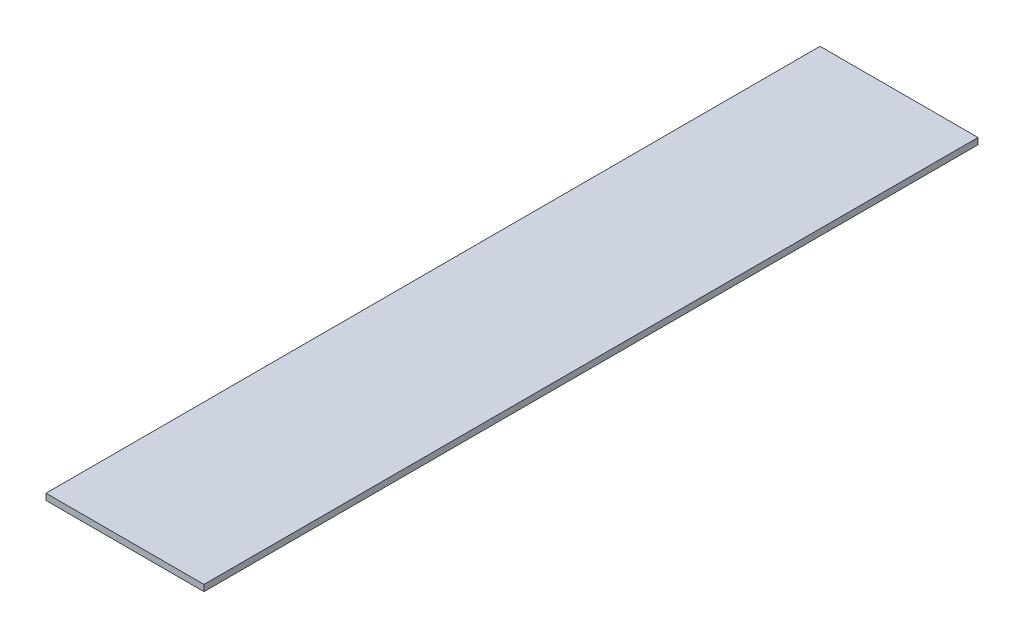
from build123d import *

# Parameters (mm, degrees)
SKETCH_1_W      = 50
SKETCH_1_H      = 245
EXTRUDE_1_DEPTH = 2


with BuildPart() as part:
    # 草图1 → 凸台-拉伸1 (new body)
    with BuildSketch(Plane(origin=(0, 0, 0), x_dir=(1, 0, 0), z_dir=(0, 1, 0))):
        with Locations((25, 122.5)):
            Rectangle(SKETCH_1_W, SKETCH_1_H)
    extrude(amount=EXTRUDE_1_DEPTH)


solid = part.part
